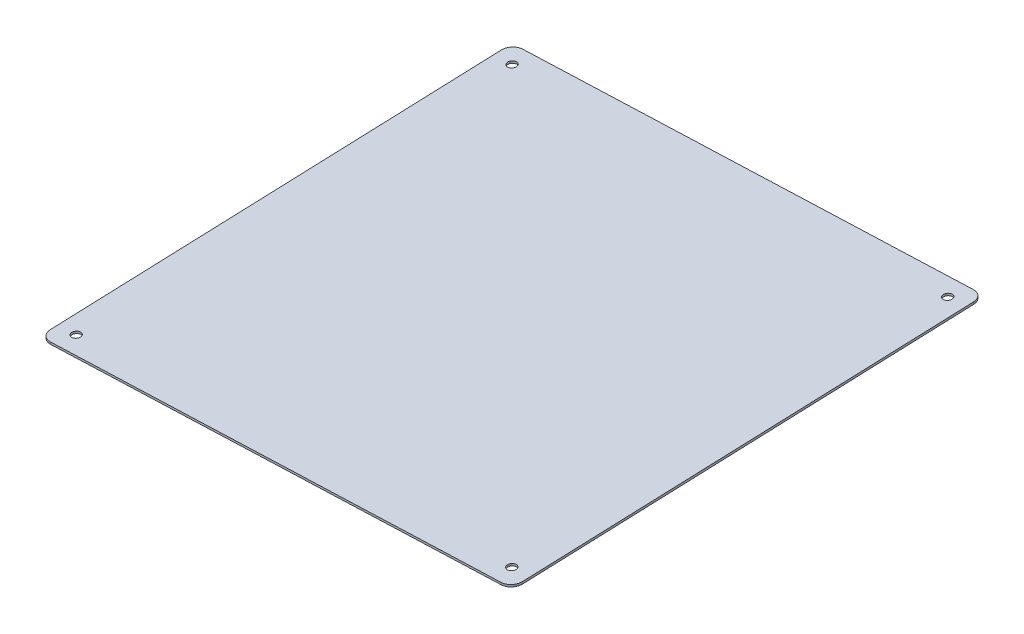
from build123d import *

# Parameters (mm, degrees)
BOSS_EXTRUDE1_DEPTH     = 2
SKETCH3_R               = 4.1
CUT_EXTRUDE1_DEPTH      = 150
MIRROR2_COPY_1_SKETCH_R = 4.1
MIRROR2_COPY_1_DEPTH    = 150


with BuildPart() as part:
    # Sketch2 → Boss-Extrude1 (new body)
    with BuildSketch(Plane(origin=(75.209264803, -1945.500458031, -70.562482719), x_dir=(0.9992543484228519, 0.038603856587709914, 0.0006995817159617483), z_dir=(-0.03860385658770992, 0.998597990155389, 0.03621872877633121))):
        with BuildLine():
            Line((-488.860391094, 45.687428375), (-68.860391094, 45.687428375))
            ThreePointArc((-68.860391094, 45.687428375), (-61.789323282, 48.616360563), (-58.860391094, 55.687428375))
            Line((-58.860391094, 55.687428375), (-58.860391094, 475.687428375))
            ThreePointArc((-58.860391094, 475.687428375), (-61.789323282, 482.758496187), (-68.860391094, 485.687428375))
            Line((-68.860391094, 485.687428375), (-488.860391094, 485.687428375))
            ThreePointArc((-488.860391094, 485.687428375), (-495.931458906, 482.758496187), (-498.860391094, 475.687428375))
            Line((-498.860391094, 475.687428375), (-498.860391094, 55.687428375))
            ThreePointArc((-498.860391094, 55.687428375), (-495.931458906, 48.616360563), (-488.860391094, 45.687428375))
        make_face()
    extrude(amount=BOSS_EXTRUDE1_DEPTH)

    # Sketch3 → Cut-Extrude1 (cut)
    with BuildSketch(Plane(origin=(-103.287183068, -1885.761116085, -334.134352796), x_dir=(-0.0006995817159619569, 0.036218728776338416, -0.9993436417325368), z_dir=(0.038603856587716694, -0.9985979901553884, -0.036218728776338416))):
        with Locations(Location((-203.071067812, 100.352249502, 0), (0, 0, 269.959890601))):
            Circle(SKETCH3_R)
    cut_extrude1 = extrude(amount=CUT_EXTRUDE1_DEPTH, mode=Mode.SUBTRACT)

    # Mirror1: Cut-Extrude1 across plane
    add(cut_extrude1.mirror(Plane(origin=(-278.652458404, -10.765086546, -0.195085631), x_dir=(-0.000699060242817171, -2.700655884307846e-05, 0.9999997552926815), z_dir=(-0.9992543484228519, -0.03860385658770997, -0.0006995817159618643))), mode=Mode.SUBTRACT)

    # Mirror2: Cut-Extrude1 across plane
    add(cut_extrude1.mirror(Plane(origin=(-0.185870067, 9.622860908, -265.513042235), x_dir=(0.9999997552926815, 2.5337966627687505e-05, -0.0006991227107992283), z_dir=(0.0006995817159618217, -0.036218728776331255, 0.9993436417325371))), mode=Mode.SUBTRACT)

    # Mirror2 copy 1 sketch → Mirror2 copy 1 (cut)
    with BuildSketch(Plane(origin=(-308.371783919, -1893.684080376, -334.277933294), x_dir=(0.0006995817159616872, -0.0362187287763241, 0.9993436417325376), z_dir=(0.03860385658770326, -0.9985979901553895, -0.0362187287763241))):
        with Locations(Location((-203.071067812, 100.352249502, 0), (0, 0, 269.959890601))):
            Circle(MIRROR2_COPY_1_SKETCH_R)
    extrude(amount=MIRROR2_COPY_1_DEPTH, mode=Mode.SUBTRACT)


solid = part.part
